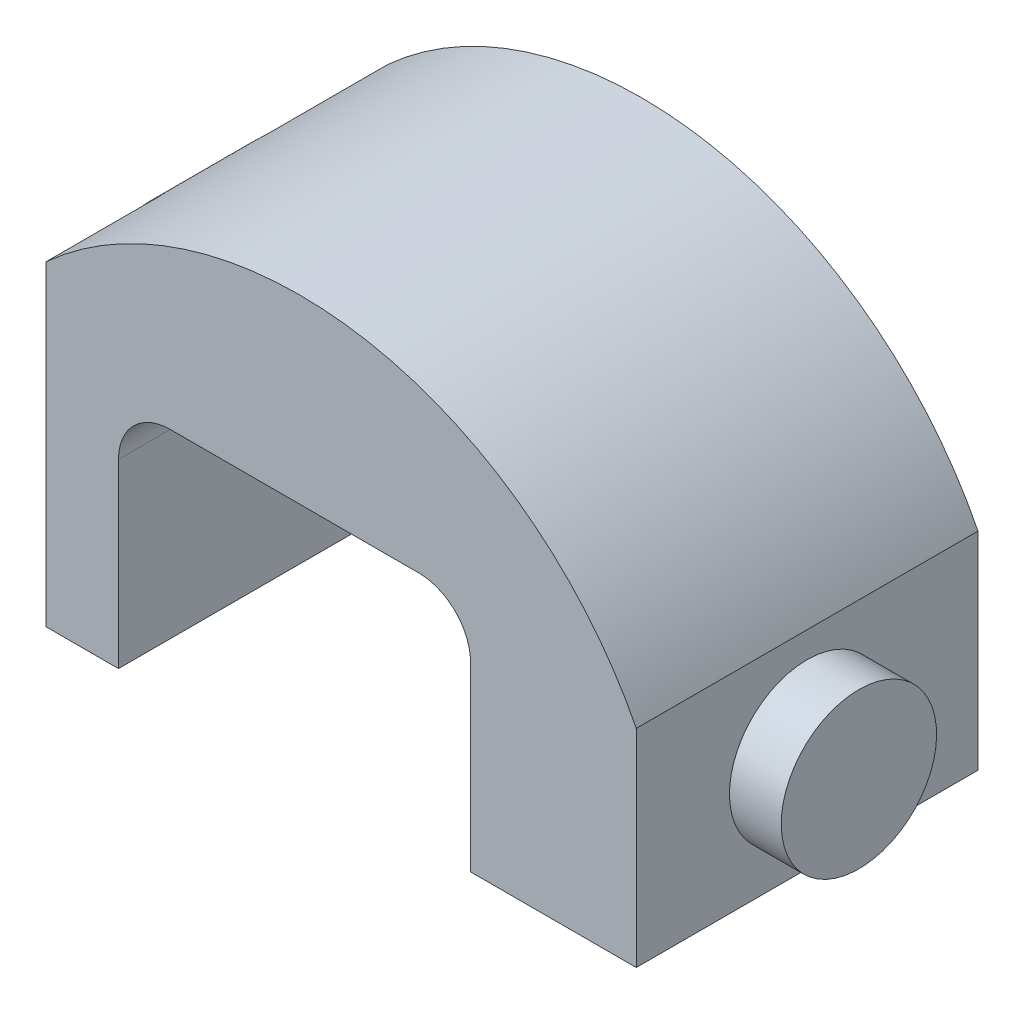
from build123d import *

# Parameters (mm, degrees)
BOSS_EXTRUDE1_DEPTH = 66
SKETCH4_R           = 15
BOSS_EXTRUDE2_DEPTH = 10
CUT_EXTRUDE2_DEPTH  = 108.615054709
SKETCH5_W           = 16
SKETCH5_H           = 23
CUT_EXTRUDE3_DEPTH  = 128.988280714
SKETCH6_W           = 10
SKETCH6_H           = 10
BOSS_EXTRUDE3_DEPTH = 5
SKETCH7_W           = 12
SKETCH7_H           = 12
BOSS_EXTRUDE4_DEPTH = 5


with BuildPart() as part:
    # Sketch2 → Boss-Extrude1 (new body)
    with BuildSketch(Plane.XY):
        with BuildLine():
            ThreePointArc((65, 0), (38.160843726, 29.198871234), (-1.89e-07, 40))
            ThreePointArc((-1.89e-07, 40), (-38.160843886, 29.198871136), (-65, 0))
            Line((-65, 0), (-65, -40))
            Line((-65, -40), (65, -40))
            Line((65, -40), (65, 0))
        make_face()
    extrude(amount=BOSS_EXTRUDE1_DEPTH)

    # Sketch4 → Boss-Extrude2 (add)
    with BuildSketch(Plane(origin=(65, 0, 0), x_dir=(0, 0, -1), z_dir=(1, 0, 0))):
        with Locations(Location((-33, -20, 0), (0, 0, 90))):
            Circle(SKETCH4_R)
    extrude(amount=BOSS_EXTRUDE2_DEPTH)

    # Sketch3 → Cut-Extrude2 (cut, through all)
    with BuildSketch(Plane.XY.offset(66)):
        with BuildLine():
            Line((-25, 5), (23, 5))
            ThreePointArc((23, 5), (30.071067812, 2.071067812), (33, -5))
            Line((33, -5), (33, -40))
            Line((33, -40), (-35, -40))
            Line((-35, -40), (-35, -5))
            ThreePointArc((-35, -5), (-32.071067812, 2.071067812), (-25, 5))
        make_face()
    extrude(amount=-CUT_EXTRUDE2_DEPTH, mode=Mode.SUBTRACT)

    # Sketch5 → Cut-Extrude3 (cut, through all)
    with BuildSketch(Plane.XZ.offset(40)):
        with Locations((-57, 54.5)):
            Rectangle(SKETCH5_W, SKETCH5_H)
        with Locations((-57, 11.5)):
            Rectangle(SKETCH5_W, SKETCH5_H)
    extrude(amount=-CUT_EXTRUDE3_DEPTH, mode=Mode.SUBTRACT)

    # Sketch6 → Boss-Extrude3 (add)
    with BuildSketch(Plane.XZ.offset(40)):
        with Locations((-48.5, 33)):
            Rectangle(SKETCH6_W, SKETCH6_H)
    extrude(amount=BOSS_EXTRUDE3_DEPTH)

    # Sketch7 → Boss-Extrude4 (add)
    with BuildSketch(Plane.XZ.offset(40)):
        with Locations((41.5, 13.9)):
            Rectangle(SKETCH7_W, SKETCH7_H)
        with Locations((41.5, 52.1)):
            Rectangle(SKETCH7_W, SKETCH7_H)
    extrude(amount=BOSS_EXTRUDE4_DEPTH)


solid = part.part
